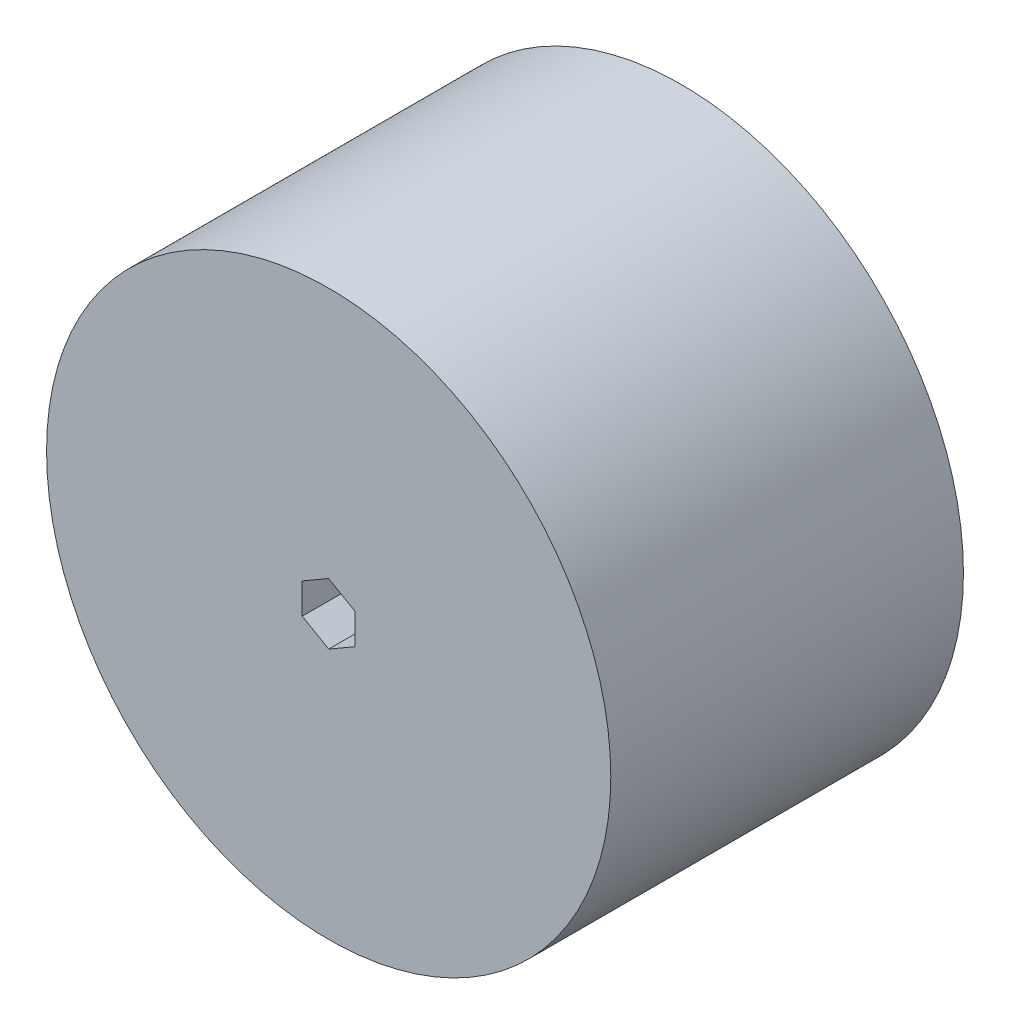
from build123d import *

# Parameters (mm, degrees)
SKETCH1_R           = 50.8
BOSS_EXTRUDE1_DEPTH = 63.5


with BuildPart() as part:
    # Sketch1 → Boss-Extrude1 (new body)
    with BuildSketch(Plane.XY):
        Circle(SKETCH1_R)
        Polygon((4.760270004, 2.753489512), (-0.004456865, 5.499259508), (-4.764726868, 2.745769996), (-4.760270004, -2.753489512), (0.004456865, -5.499259508), (4.764726868, -2.745769996), align=None, mode=Mode.SUBTRACT)
    extrude(amount=BOSS_EXTRUDE1_DEPTH)


solid = part.part
